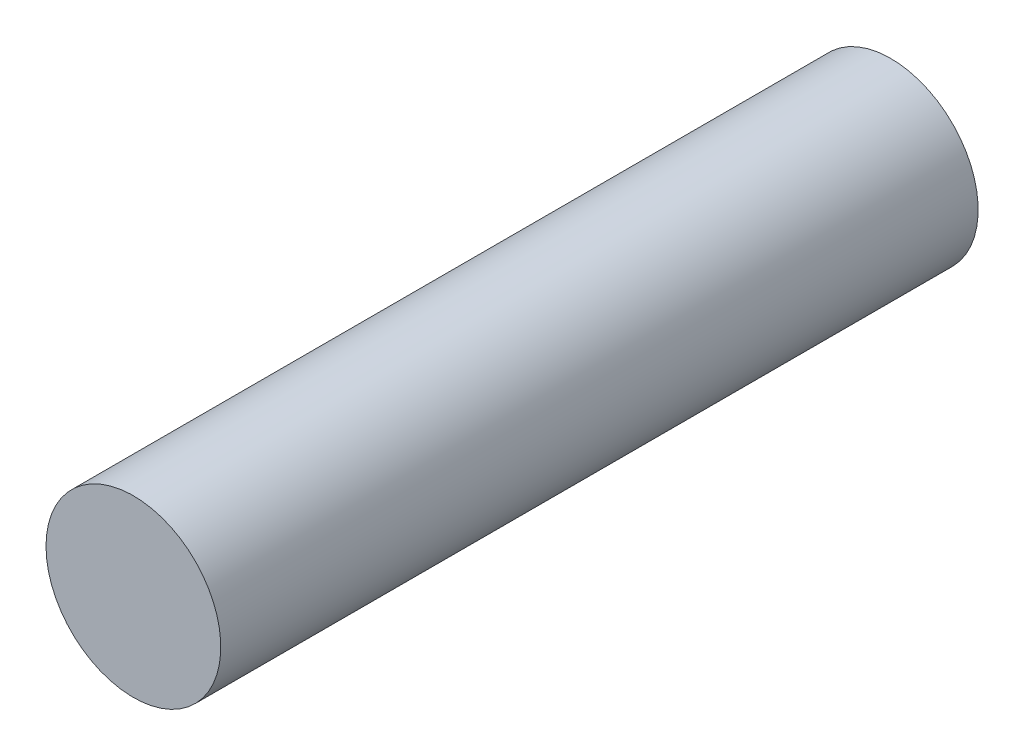
from build123d import *

# Parameters (mm, degrees)
SKETCH1_R           = 3
BOSS_EXTRUDE1_DEPTH = 26


with BuildPart() as part:
    # Sketch1 → Boss-Extrude1 (new body)
    with BuildSketch(Plane.XY):
        with Locations(Location((0, 0, 0), (0, 0, 180))):
            Circle(SKETCH1_R)
    extrude(amount=BOSS_EXTRUDE1_DEPTH)


solid = part.part
